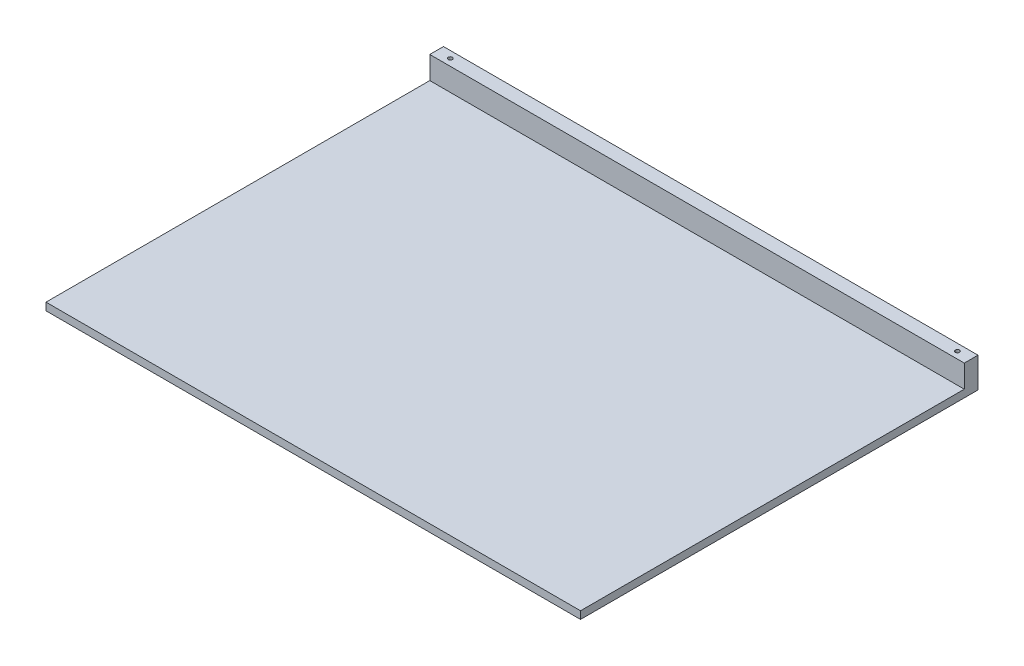
from build123d import *

# Parameters (mm, degrees)
CROQUIS2_W                 = 390
CROQUIS2_H                 = 290
SALIENTE_EXTRUIR2_DEPTH    = 10
CROQUIS3_W                 = 390
CROQUIS3_H                 = 7
SALIENTE_EXTRUIR3_DEPTH    = 25
SALIENTE_EXTRUIR4_DEPTH    = 390
CORTAR_EXTRUIR1_DEPTH      = 180
CORTAR_EXTRUIR2_DEPTH      = 180
SALIENTE_EXTRUIR5_DEPTH    = 179
CROQUIS10_W                = 283
CROQUIS10_H                = 194.109962813
CORTAR_EXTRUIR5_DEPTH      = 236
CORTAR_EXTRUIR6_DEPTH      = 236
SALIENTE_EXTRUIR6_DEPTH    = 236
CROQUIS13_W                = 339.798946509
CROQUIS13_H                = 236.819651801
CROQUIS13_W_2              = 44.776464784
CROQUIS13_H_2              = 75.104657821
CORTAR_EXTRUIR7_DEPTH      = 500
CROQUIS14_W                = 59.446000687
CROQUIS14_H                = 81.435889979
CORTAR_EXTRUIR8_DEPTH      = 500
CROQUIS15_W                = 50
CROQUIS15_H                = 5
CORTAR_EXTRUIR9_DEPTH      = 500
CROQUIS16_W                = 390
CROQUIS16_H                = 283
CORTAR_EXTRUIR10_DEPTH     = 10
CROQUIS17_R                = 3.75
CORTAR_EXTRUIR11_DEPTH     = 10
CROQUIS18_R                = 3.75
CROQUIS18_R_2              = 1.5
SALIENTE_EXTRUIR8_DEPTH    = 4
CROQUIS19_R                = 1.5
SALIENTE_EXTRUIR10_DEPTH   = 15
CROQUIS20_R                = 1.5
SALIENTE_EXTRUIR11_DEPTH   = 15
SALIENTE_EXTRUIR11_2_DEPTH = 15
SALIENTE_EXTRUIR11_3_DEPTH = 15
CROQUIS21_W                = 390
CROQUIS21_H                = 283
SALIENTE_EXTRUIR12_DEPTH   = 10
CORTAR_EXTRUIR12_START     = -47
CROQUIS22_R                = 1.5
CORTAR_EXTRUIR12_DEPTH     = 47
CROQUIS26_W                = 283
CROQUIS26_H                = 4.5
CORTAR_EXTRUIR16_DEPTH     = 500
CROQUIS27_W                = 7
CROQUIS27_H                = 9.5
CORTAR_EXTRUIR17_DEPTH     = 500
CORTAR_EXTRUIR18_DEPTH     = 500
CROQUIS29_R                = 3.5
CORTAR_EXTRUIR19_DEPTH     = 20
CORTAR_EXTRUIR20_DEPTH     = 314
CROQUIS32_R                = 3.5
CORTAR_EXTRUIR21_DEPTH     = 25
CROQUIS33_W                = 308.833685193
CROQUIS33_H                = 37.038834889
CORTAR_EXTRUIR22_DEPTH     = 500
CROQUIS34_W                = 390
CROQUIS34_H                = 290
CROQUIS34_R                = 1.5
SALIENTE_EXTRUIR14_DEPTH   = 5.5
CROQUIS35_W                = 390
CROQUIS35_H                = 10
SALIENTE_EXTRUIR15_DEPTH   = 22
CORTAR_EXTRUIR23_DEPTH     = 488
CORTAR_EXTRUIR28_DEPTH     = 479.5
CROQUIS38_R                = 3.5
CORTAR_EXTRUIR29_DEPTH     = 25
CROQUIS39_R                = 1.5
SALIENTE_EXTRUIR16_DEPTH   = 9
CROQUIS40_R                = 3.5
SALIENTE_EXTRUIR17_DEPTH   = 25
CROQUIS41_R                = 3.5
CORTAR_EXTRUIR30_DEPTH     = 25
CROQUIS43_W                = 307.128340428
CROQUIS43_H                = 102.232085181
CORTAR_EXTRUIR32_DEPTH     = 500
CROQUIS44_R                = 1.5
CORTAR_EXTRUIR34_DEPTH     = 50
CROQUIS45_W                = 390
CROQUIS45_H                = 290
CORTAR_EXTRUIR37_DEPTH     = 50
SALIENTE_EXTRUIR19_START   = 16.5
CROQUIS46_W                = 390
CROQUIS46_H                = 10
CROQUIS46_R                = 1.5
SALIENTE_EXTRUIR19_DEPTH   = 16.5
CROQUIS48_W                = 390
CROQUIS48_H                = 280
CORTAR_EXTRUIR38_DEPTH     = 16.5
CROQUIS49_W                = 390
CROQUIS49_H                = 280
SALIENTE_EXTRUIR20_DEPTH   = 5.5


with BuildPart() as part:
    # Croquis2 → Saliente-Extruir2 (new body)
    with BuildSketch(Plane(origin=(0, 0, 0), x_dir=(1, 0, 0), z_dir=(0, 1, 0))):
        Rectangle(CROQUIS2_W, CROQUIS2_H)
    extrude(amount=SALIENTE_EXTRUIR2_DEPTH)

    # Croquis3 → Saliente-Extruir3 (add)
    with BuildSketch(Plane(origin=(0, 10, 0), x_dir=(1, 0, 0), z_dir=(0, 1, 0))):
        with Locations((0, -141.5)):
            Rectangle(CROQUIS3_W, CROQUIS3_H)
    extrude(amount=SALIENTE_EXTRUIR3_DEPTH)

    # Croquis5 → Saliente-Extruir4 (add)
    with BuildSketch(Plane.ZY.offset(195)):
        Polygon((145, 0), (51.120689647, -135.689627782), (-145, 0), align=None)
    extrude(amount=-SALIENTE_EXTRUIR4_DEPTH)

    # Croquis6 → Cortar-Extruir1 (cut)
    with BuildSketch(Plane.ZY.offset(195)):
        Polygon((-145, 0), (145, 0), (51.120689647, -135.689627782), align=None)
    extrude(amount=-CORTAR_EXTRUIR1_DEPTH, mode=Mode.SUBTRACT)

    # Croquis7 → Cortar-Extruir2 (cut)
    with BuildSketch(Plane(origin=(195, 0, 0), x_dir=(0, 0, -1), z_dir=(1, 0, 0))):
        Polygon((145, 0), (-145, 0), (-51.120689647, -135.689627782), align=None)
    extrude(amount=-CORTAR_EXTRUIR2_DEPTH, mode=Mode.SUBTRACT)

    # Croquis8 → Saliente-Extruir5 (add)
    with BuildSketch(Plane(origin=(0, -67.844813894, -46.939655172), x_dir=(-1, 0, 0), z_dir=(0, -0.8223613805318496, -0.5689655172413796))):
        Polygon((15, -119.242400168), (105, 119.242400177), (75, 119.242400177), (15, -39.747466719), align=None)
    extrude(amount=-SALIENTE_EXTRUIR5_DEPTH)

    # Croquis10 → Cortar-Extruir5 (cut)
    with BuildSketch(Plane.ZY.offset(195)):
        with Locations((-3.5, 107.054981407)):
            Rectangle(CROQUIS10_W, CROQUIS10_H)
    extrude(amount=-CORTAR_EXTRUIR5_DEPTH, mode=Mode.SUBTRACT)

    # Croquis11 → Cortar-Extruir6 (cut)
    with BuildSketch(Plane.ZY.offset(195)):
        Polygon((145, 17.024145748), (144.999999988, 0), (165.789590248, 1.603195777), (161.358166331, 19.30887792), align=None)
    extrude(amount=-CORTAR_EXTRUIR6_DEPTH, mode=Mode.SUBTRACT)

    # Croquis12 → Saliente-Extruir6 (add)
    with BuildSketch(Plane(origin=(0, -67.844813894, -46.939655172), x_dir=(-1, 0, 0), z_dir=(0, -0.8223613805318496, -0.5689655172413796))):
        Polygon((-15, -119.242400168), (-105, 119.242400177), (-75, 119.242400177), (-15, -39.747466719), align=None)
    extrude(amount=-SALIENTE_EXTRUIR6_DEPTH)

    # Croquis13 → Cortar-Extruir7 (cut)
    with BuildSketch(Plane(origin=(195, 0, 0), x_dir=(0, 0, -1), z_dir=(1, 0, 0))):
        with Locations((31.899473255, 128.409825901)):
            Rectangle(CROQUIS13_W, CROQUIS13_H)
        with Locations((-167.388232392, 37.552328911)):
            Rectangle(CROQUIS13_W_2, CROQUIS13_H_2)
    extrude(amount=-CORTAR_EXTRUIR7_DEPTH, mode=Mode.SUBTRACT)

    # Croquis14 → Cortar-Extruir8 (cut)
    with BuildSketch(Plane(origin=(195, 0, 0), x_dir=(0, 0, -1), z_dir=(1, 0, 0))):
        with Locations((-167.723000344, 75.71794499)):
            Rectangle(CROQUIS14_W, CROQUIS14_H)
    extrude(amount=-CORTAR_EXTRUIR8_DEPTH, mode=Mode.SUBTRACT)

    # Croquis15 → Cortar-Extruir9 (cut)
    with BuildSketch(Plane.ZY.offset(195)):
        with Locations((-102, -2.5)):
            Rectangle(CROQUIS15_W, CROQUIS15_H)
    extrude(amount=-CORTAR_EXTRUIR9_DEPTH, mode=Mode.SUBTRACT)

    # Croquis16 → Cortar-Extruir10 (cut)
    with BuildSketch(Plane(origin=(0, 10, 0), x_dir=(1, 0, 0), z_dir=(0, 1, 0))):
        with Locations((0, 3.5)):
            Rectangle(CROQUIS16_W, CROQUIS16_H)
    extrude(amount=-CORTAR_EXTRUIR10_DEPTH, mode=Mode.SUBTRACT)

    # Croquis17 → Cortar-Extruir11 (cut)
    with BuildSketch(Plane(origin=(0, 0, 0), x_dir=(1, 0, 0), z_dir=(0, 1, 0))):
        with Locations(Location((-87.205, 136, 0), (0, 0, 270))):
            Circle(CROQUIS17_R)
        with Locations(Location((0, 136, 0), (0, 0, 270))):
            Circle(CROQUIS17_R)
        with Locations(Location((87.205, 136, 0), (0, 0, 270))):
            Circle(CROQUIS17_R)
    extrude(amount=-CORTAR_EXTRUIR11_DEPTH, mode=Mode.SUBTRACT)

    # Croquis18 → Saliente-Extruir8 (add)
    # profile 1 of 3: a face of its own
    with BuildSketch(Plane(origin=(0, 0, 0), x_dir=(1, 0, 0), z_dir=(0, 1, 0))):
        with Locations((-87.205, 136)):
            Circle(CROQUIS18_R)
        with Locations(Location((-87.205, 136, 0), (0, 0, 270))):
            Circle(CROQUIS18_R_2, mode=Mode.SUBTRACT)
    # profile 2 of 3: a face of its own
    with BuildSketch(Plane(origin=(0, 0, 0), x_dir=(1, 0, 0), z_dir=(0, 1, 0))):
        with Locations((0, 136)):
            Circle(CROQUIS18_R)
        with Locations(Location((0, 136, 0), (0, 0, 270))):
            Circle(CROQUIS18_R_2, mode=Mode.SUBTRACT)
    # profile 3 of 3: a face of its own
    with BuildSketch(Plane(origin=(0, 0, 0), x_dir=(1, 0, 0), z_dir=(0, 1, 0))):
        with Locations((87.205, 136)):
            Circle(CROQUIS18_R)
        with Locations(Location((87.205, 136, 0), (0, 0, 270))):
            Circle(CROQUIS18_R_2, mode=Mode.SUBTRACT)
    extrude(amount=-SALIENTE_EXTRUIR8_DEPTH)

    # Croquis19 → Saliente-Extruir10 (add)
    with BuildSketch(Plane(origin=(0, 0, 0), x_dir=(1, 0, 0), z_dir=(0, 1, 0))):
        with Locations(Location((-52.533337706, 22, 0), (0, 0, 270))):
            Circle(CROQUIS19_R)
        with Locations(Location((0, 22, 0), (0, 0, 270))):
            Circle(CROQUIS19_R)
        with Locations(Location((52.533337706, 22, 0), (0, 0, 270))):
            Circle(CROQUIS19_R)
        with Locations(Location((0, -58, 0), (0, 0, 270))):
            Circle(CROQUIS19_R)
        with Locations(Location((0, -116, 0), (0, 0, 270))):
            Circle(CROQUIS19_R)
    extrude(amount=SALIENTE_EXTRUIR10_DEPTH)



with BuildPart() as body_2:
    # Croquis20 → Saliente-Extruir11 (new body)
    with BuildSketch(Plane(origin=(0, 0, 0), x_dir=(1, 0, 0), z_dir=(0, 1, 0))):
        with Locations(Location((-87.205, 136, 0), (0, 0, 270))):
            Circle(CROQUIS20_R)
    extrude(amount=SALIENTE_EXTRUIR11_DEPTH)


with BuildPart() as body_3:
    # Croquis20 → Saliente-Extruir11 2 (new body)
    with BuildSketch(Plane(origin=(0, 0, 0), x_dir=(1, 0, 0), z_dir=(0, 1, 0))):
        with Locations(Location((0, 136, 0), (0, 0, 270))):
            Circle(CROQUIS20_R)
    extrude(amount=SALIENTE_EXTRUIR11_2_DEPTH)


with BuildPart() as body_4:
    # Croquis20 → Saliente-Extruir11 3 (new body)
    with BuildSketch(Plane(origin=(0, 0, 0), x_dir=(1, 0, 0), z_dir=(0, 1, 0))):
        with Locations(Location((87.205, 136, 0), (0, 0, 270))):
            Circle(CROQUIS20_R)
    extrude(amount=SALIENTE_EXTRUIR11_3_DEPTH)


with BuildPart() as part_1:
    add(part.part)

    add(body_2.part)  # Saliente-Extruir12 merges body 2

    add(body_3.part)  # Saliente-Extruir12 merges body 3

    add(body_4.part)  # Saliente-Extruir12 merges body 4
    # Croquis21 → Saliente-Extruir12 (add)
    with BuildSketch(Plane(origin=(0, 0, 0), x_dir=(1, 0, 0), z_dir=(0, 1, 0))):
        with Locations((0, 3.5)):
            Rectangle(CROQUIS21_W, CROQUIS21_H)
    extrude(amount=SALIENTE_EXTRUIR12_DEPTH)

    # Croquis22 → Cortar-Extruir12 (cut)
    with BuildSketch(Plane(origin=(0, 15, 0), x_dir=(1, 0, 0), z_dir=(0, 1, 0)).offset(CORTAR_EXTRUIR12_START)):
        with Locations(Location((0, -116, 0), (0, 0, 270))):
            Circle(CROQUIS22_R)
        with Locations(Location((0, -58, 0), (0, 0, 270))):
            Circle(CROQUIS22_R)
        with Locations(Location((-52.533337706, 22, 0), (0, 0, 270))):
            Circle(CROQUIS22_R)
        with Locations(Location((0, 22, 0), (0, 0, 270))):
            Circle(CROQUIS22_R)
        with Locations(Location((52.533337706, 22, 0), (0, 0, 270))):
            Circle(CROQUIS22_R)
        with Locations(Location((87.205, 136, 0), (0, 0, 270))):
            Circle(CROQUIS22_R)
        with Locations(Location((0, 136, 0), (0, 0, 270))):
            Circle(CROQUIS22_R)
        with Locations(Location((-87.205, 136, 0), (0, 0, 270))):
            Circle(CROQUIS22_R)
    extrude(amount=CORTAR_EXTRUIR12_DEPTH, mode=Mode.SUBTRACT)

    # Croquis26 → Cortar-Extruir16 (cut)
    with BuildSketch(Plane.ZY.offset(195)):
        with Locations((-3.5, 7.75)):
            Rectangle(CROQUIS26_W, CROQUIS26_H)
    extrude(amount=-CORTAR_EXTRUIR16_DEPTH, mode=Mode.SUBTRACT)

    # Croquis27 → Cortar-Extruir17 (cut)
    with BuildSketch(Plane.ZY.offset(195)):
        with Locations((141.5, 30.25)):
            Rectangle(CROQUIS27_W, CROQUIS27_H)
    extrude(amount=-CORTAR_EXTRUIR17_DEPTH, mode=Mode.SUBTRACT)

    # Croquis28 → Cortar-Extruir18 (cut)
    with BuildSketch(Plane.ZY.offset(195)):
        Polygon((51.120689647, -135.689627782), (80.706896544, -92.926835995), (49.045983393, -71.021663581), (19.459776497, -113.784455368), align=None)
    extrude(amount=-CORTAR_EXTRUIR18_DEPTH, mode=Mode.SUBTRACT)

    # Croquis29 → Cortar-Extruir19 (cut)
    with BuildSketch(Plane(origin=(0, -25.082022106, -17.353448276), x_dir=(-1, 0, 0), z_dir=(0, -0.8223613805318496, -0.5689655172413796))):
        with Locations(Location((0, -91.242400168, 0), (0, 0, 90))):
            Circle(CROQUIS29_R)
    extrude(amount=-CORTAR_EXTRUIR19_DEPTH, mode=Mode.SUBTRACT)

    # Croquis31 → Cortar-Extruir20 (cut)
    with BuildSketch(Plane(origin=(195, 0, 0), x_dir=(0, 0, -1), z_dir=(1, 0, 0))):
        Polygon((-71.450630314, -70.714586325), (-76.002354452, -64.13569528), (-63.255753053, -55.316729763), (-58.704028915, -61.895620807), align=None)
    extrude(amount=-CORTAR_EXTRUIR20_DEPTH, mode=Mode.SUBTRACT)

    # Croquis32 → Cortar-Extruir21 (cut)
    with BuildSketch(Plane(origin=(0, -67.844813897, 98.06034482), x_dir=(1, 0, 0), z_dir=(0, -0.568965517289267, 0.8223613804987178))):
        with Locations(Location((0, 47.5, 0), (0, 0, 270))):
            Circle(CROQUIS32_R)
    extrude(amount=-CORTAR_EXTRUIR21_DEPTH, mode=Mode.SUBTRACT)

    # Croquis33 → Cortar-Extruir22 (cut)
    with BuildSketch(Plane(origin=(195, 0, 0), x_dir=(0, 0, -1), z_dir=(1, 0, 0))):
        with Locations((9.416842597, 18.519417445)):
            Rectangle(CROQUIS33_W, CROQUIS33_H)
    extrude(amount=-CORTAR_EXTRUIR22_DEPTH, mode=Mode.SUBTRACT)

    # Croquis34 → Saliente-Extruir14 (add)
    with BuildSketch(Plane(origin=(0, 0, 0), x_dir=(1, 0, 0), z_dir=(0, 1, 0))):
        Rectangle(CROQUIS34_W, CROQUIS34_H)
        with Locations(Location((0, -58, 0), (0, 0, 270))):
            Circle(CROQUIS34_R, mode=Mode.SUBTRACT)
        with Locations(Location((0, -116, 0), (0, 0, 270))):
            Circle(CROQUIS34_R, mode=Mode.SUBTRACT)
        with Locations(Location((-52.533337706, 22, 0), (0, 0, 270))):
            Circle(CROQUIS34_R, mode=Mode.SUBTRACT)
        with Locations(Location((0, 22, 0), (0, 0, 270))):
            Circle(CROQUIS34_R, mode=Mode.SUBTRACT)
        with Locations(Location((52.533337706, 22, 0), (0, 0, 270))):
            Circle(CROQUIS34_R, mode=Mode.SUBTRACT)
        with Locations(Location((-87.205, 136, 0), (0, 0, 270))):
            Circle(CROQUIS34_R, mode=Mode.SUBTRACT)
        with Locations(Location((0, 136, 0), (0, 0, 270))):
            Circle(CROQUIS34_R, mode=Mode.SUBTRACT)
        with Locations(Location((87.205, 136, 0), (0, 0, 270))):
            Circle(CROQUIS34_R, mode=Mode.SUBTRACT)
    extrude(amount=SALIENTE_EXTRUIR14_DEPTH)

    # Croquis35 → Saliente-Extruir15 (add)
    with BuildSketch(Plane(origin=(0, 5.5, 0), x_dir=(1, 0, 0), z_dir=(0, 1, 0))):
        with Locations((0, -140)):
            Rectangle(CROQUIS35_W, CROQUIS35_H)
    extrude(amount=SALIENTE_EXTRUIR15_DEPTH)

    # Croquis36 → Cortar-Extruir23 (cut)
    with BuildSketch(Plane.ZY.offset(195)):
        Polygon((19.459776497, -113.784455368), (-123.319563604, -15), (49.045983393, -71.021663581), align=None)
    extrude(amount=-CORTAR_EXTRUIR23_DEPTH, mode=Mode.SUBTRACT)

    # Croquis37 → Cortar-Extruir28 (cut)
    with BuildSketch(Plane.ZY.offset(195)):
        with BuildLine():
            Line((-115.772134461, -17.453039739), (39.045983393, -17.453039739))
            ThreePointArc((39.045983393, -17.453039739), (46.117051205, -20.381971927), (49.045983393, -27.453039739))
            Line((49.045983393, -27.453039739), (49.045983393, -71.021663581))
            Line((49.045983393, -71.021663581), (-115.772134461, -17.453039739))
        make_face()
    extrude(amount=-CORTAR_EXTRUIR28_DEPTH, mode=Mode.SUBTRACT)

    # Croquis38 → Cortar-Extruir29 (cut)
    with BuildSketch(Plane(origin=(0, -67.844813897, 98.06034482), x_dir=(1, 0, 0), z_dir=(0, -0.568965517289267, 0.8223613804987178))):
        with Locations((0, 44.5)):
            Circle(CROQUIS38_R)
    extrude(amount=-CORTAR_EXTRUIR29_DEPTH, mode=Mode.SUBTRACT)

    # Croquis39 → Saliente-Extruir16 (add)
    with BuildSketch(Plane(origin=(0, -32, 0), x_dir=(1, 0, 0), z_dir=(0, 1, 0))):
        with Locations(Location((0, -116, 0), (0, 0, 270))):
            Circle(CROQUIS39_R)
    extrude(amount=SALIENTE_EXTRUIR16_DEPTH)

    # Croquis40 → Saliente-Extruir17 (add)
    with BuildSketch(Plane(origin=(0, -67.844813897, 98.06034482), x_dir=(1, 0, 0), z_dir=(0, -0.568965517289267, 0.8223613804987178))):
        with Locations((0, 47.5)):
            Circle(CROQUIS40_R)
    extrude(amount=-SALIENTE_EXTRUIR17_DEPTH)

    # Croquis41 → Cortar-Extruir30 (cut)
    with BuildSketch(Plane(origin=(0, -67.844813897, 98.06034482), x_dir=(1, 0, 0), z_dir=(0, -0.568965517289267, 0.8223613804987178))):
        with Locations(Location((0, 44.5, 0), (0, 0, 270))):
            Circle(CROQUIS41_R)
    extrude(amount=-CORTAR_EXTRUIR30_DEPTH, mode=Mode.SUBTRACT)

    # Croquis43 → Cortar-Extruir32 (cut)
    with BuildSketch(Plane.ZY.offset(195)):
        with Locations((8.564170214, -51.116042591)):
            Rectangle(CROQUIS43_W, CROQUIS43_H)
    extrude(amount=-CORTAR_EXTRUIR32_DEPTH, mode=Mode.SUBTRACT)

    # Croquis44 → Cortar-Extruir34 (cut)
    with BuildSketch(Plane(origin=(0, 27.5, 0), x_dir=(1, 0, 0), z_dir=(0, 1, 0))):
        with Locations(Location((-185, -140, 0), (0, 0, 270))):
            Circle(CROQUIS44_R)
        with Locations(Location((185, -140, 0), (0, 0, 270))):
            Circle(CROQUIS44_R)
    extrude(amount=-CORTAR_EXTRUIR34_DEPTH, mode=Mode.SUBTRACT)

    # Croquis45 → Cortar-Extruir37 (cut)
    with BuildSketch(Plane(origin=(0, 5.5, 0), x_dir=(1, 0, 0), z_dir=(0, 1, 0))):
        Rectangle(CROQUIS45_W, CROQUIS45_H)
    extrude(amount=CORTAR_EXTRUIR37_DEPTH, mode=Mode.SUBTRACT)

    # Croquis46 → Saliente-Extruir19 (add)
    with BuildSketch(Plane(origin=(0, 5.5, 0), x_dir=(1, 0, 0), z_dir=(0, 1, 0)).offset(SALIENTE_EXTRUIR19_START)):
        with Locations((0, -140)):
            Rectangle(CROQUIS46_W, CROQUIS46_H)
        with Locations(Location((-185, -140, 0), (0, 0, 270))):
            Circle(CROQUIS46_R, mode=Mode.SUBTRACT)
        with Locations(Location((185, -140, 0), (0, 0, 270))):
            Circle(CROQUIS46_R, mode=Mode.SUBTRACT)
    extrude(amount=-SALIENTE_EXTRUIR19_DEPTH)

    # Croquis48 → Cortar-Extruir38 (cut)
    with BuildSketch(Plane(origin=(0, 5.5, 0), x_dir=(1, 0, 0), z_dir=(0, 1, 0))):
        with Locations((0, 5)):
            Rectangle(CROQUIS48_W, CROQUIS48_H)
    extrude(amount=-CORTAR_EXTRUIR38_DEPTH, mode=Mode.SUBTRACT)

    # Croquis49 → Saliente-Extruir20 (add)
    with BuildSketch(Plane(origin=(0, 0, 0), x_dir=(-1, 0, 0), z_dir=(0, -1, 0))):
        with Locations((0, -285)):
            Rectangle(CROQUIS49_W, CROQUIS49_H)
    extrude(amount=-SALIENTE_EXTRUIR20_DEPTH)


solid = part_1.part
